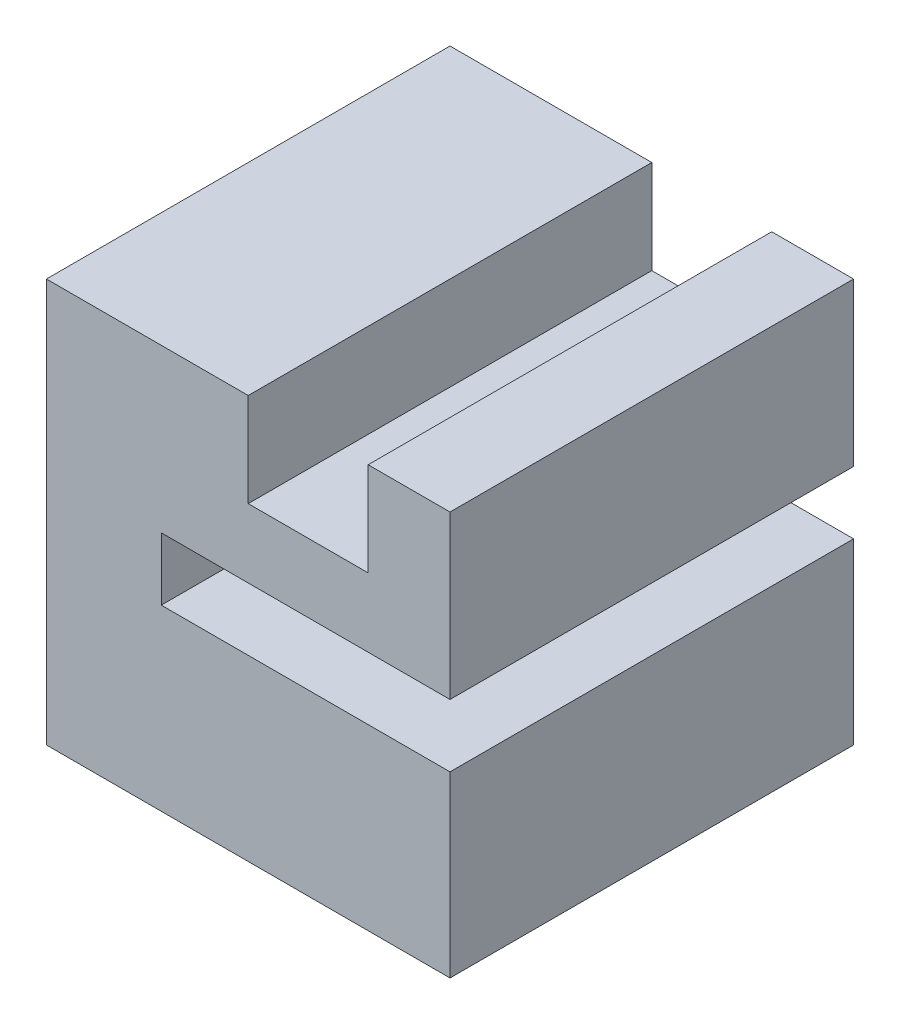
from build123d import *

# Parameters (mm, degrees)
ESQUISSE1_W             = 40
ESQUISSE1_H             = 40
BOSS_EXTRU_1_DEPTH      = 40
ESQUISSE2_W             = 11.88744648
ESQUISSE2_H             = 13.757381882
ESQUISSE2_W_2           = 32.857436339
ESQUISSE2_H_2           = 6.210856869
ENL_V_MAT_EXTRU_1_DEPTH = 40


with BuildPart() as part:
    # Esquisse1 → Boss.-Extru.1 (new body)
    with BuildSketch(Plane.XY):
        with Locations((20, 20)):
            Rectangle(ESQUISSE1_W, ESQUISSE1_H)
    extrude(amount=BOSS_EXTRU_1_DEPTH)

    # Esquisse2 → Enlèv. mat.-Extru.1 (cut)
    with BuildSketch(Plane.XY.offset(40)):
        with Locations((25.94372324, 37.597427795)):
            Rectangle(ESQUISSE2_W, ESQUISSE2_H)
        with Locations((27.813658641, 20.801400886)):
            Rectangle(ESQUISSE2_W_2, ESQUISSE2_H_2)
    extrude(amount=-ENL_V_MAT_EXTRU_1_DEPTH, mode=Mode.SUBTRACT)


solid = part.part
